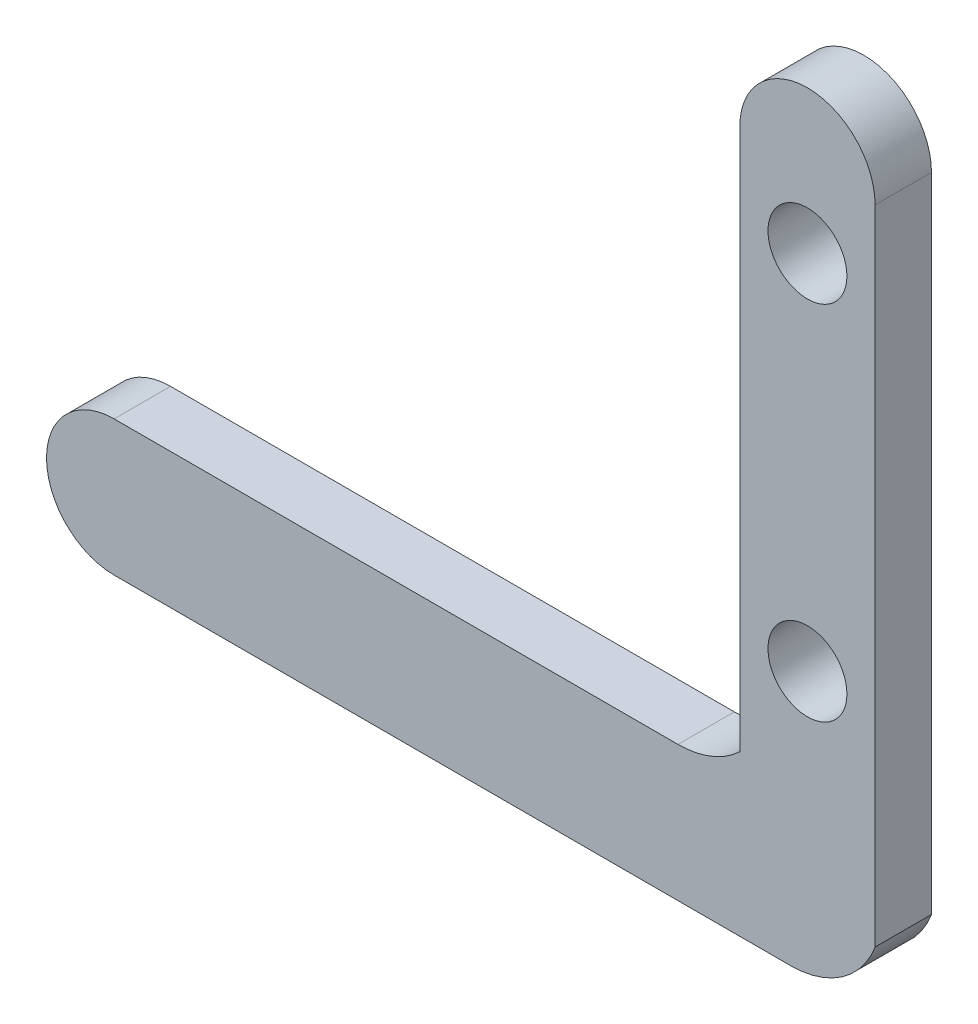
from build123d import *

# Parameters (mm, degrees)
BOSS_EXTRUDE1_DEPTH = 5
SKETCH2_R           = 3.5
CUT_EXTRUDE1_DEPTH  = 5


with BuildPart() as part:
    # Sketch1 → Boss-Extrude1 (new body)
    with BuildSketch(Plane.XY):
        with BuildLine():
            Line((-38.410546364, 12), (11.589453636, 12))
            ThreePointArc((11.589453636, 12), (14.540073806, 12.564017172), (17.074643865, 14.176539847))
            Line((17.074643865, 14.176539847), (17.074643865, 62.176539847))
            ThreePointArc((17.074643865, 62.176539847), (23.074643865, 68.176539847), (29.074643865, 62.176539847))
            Line((29.074643865, 62.176539847), (29.074643865, 5.176539847))
            ThreePointArc((29.074643865, 5.176539847), (26.139855749, 1.420194485), (21.589453636, 0))
            Line((21.589453636, 0), (-38.410546364, 0))
            ThreePointArc((-38.410546364, 0), (-44.410546364, 6), (-38.410546364, 12))
        make_face()
    extrude(amount=BOSS_EXTRUDE1_DEPTH)

    # Sketch2 → Cut-Extrude1 (cut)
    with BuildSketch(Plane.XY.offset(5)):
        with Locations((23.074643865, 55.451007907)):
            Circle(SKETCH2_R)
        with Locations((23.074643865, 23.359901288)):
            Circle(SKETCH2_R)
    extrude(amount=-CUT_EXTRUDE1_DEPTH, mode=Mode.SUBTRACT)


solid = part.part
